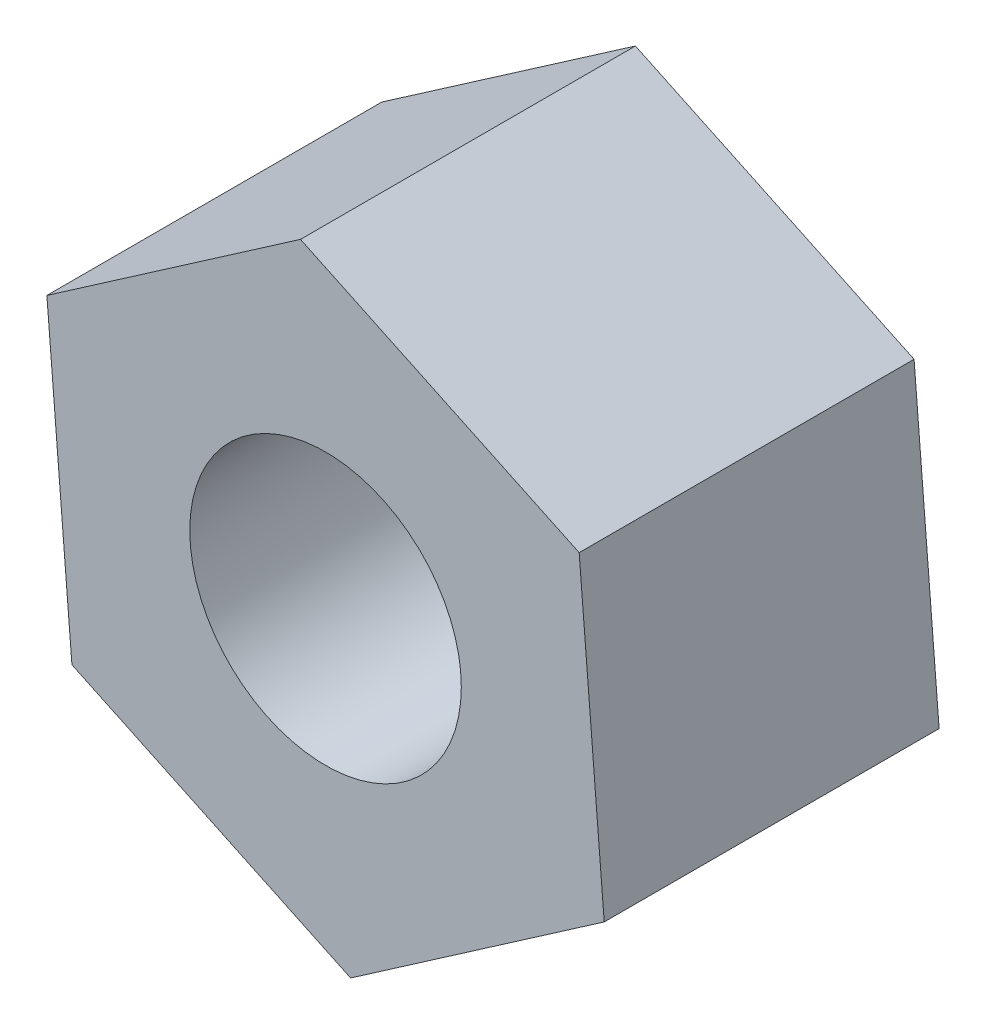
from build123d import *

# Parameters (mm, degrees)
ESQUISSE1_R        = 1.5
BOSS_EXTRU_1_DEPTH = 3.7


with BuildPart() as part:
    # Esquisse1 → Boss.-Extru.1 (new body)
    with BuildSketch(Plane.XY):
        Polygon((-0.276697102, 3.39511002), (-3.078600077, 1.45792829), (-2.801902975, -1.937181729), (0.276697102, -3.39511002), (3.078600077, -1.45792829), (2.801902975, 1.937181729), align=None)
        Circle(ESQUISSE1_R, mode=Mode.SUBTRACT)
    extrude(amount=BOSS_EXTRU_1_DEPTH)


solid = part.part
